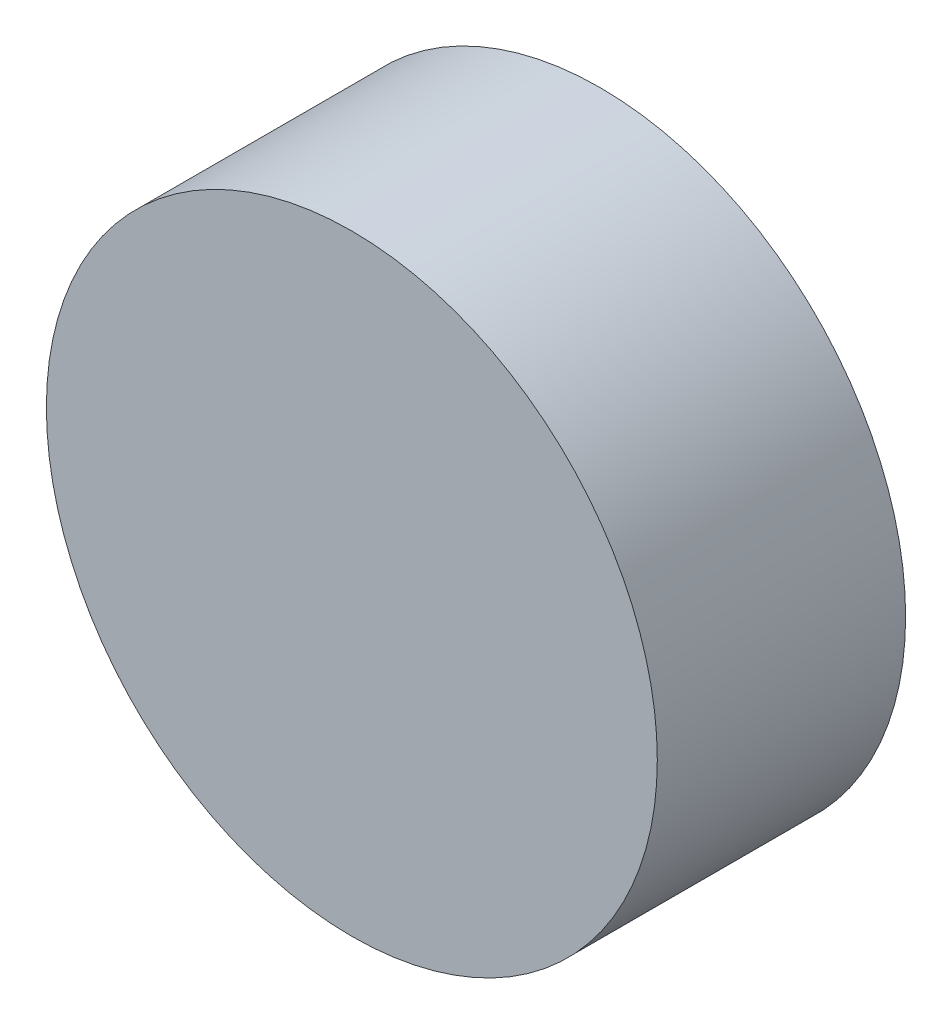
from build123d import *

# Parameters (mm, degrees)
SKETCH1_R           = 3.875
BOSS_EXTRUDE1_DEPTH = 3.15
SHELL1_T            = -1.45


with BuildPart() as part:
    # Sketch1 → Boss-Extrude1 (new body)
    with BuildSketch(Plane.XY):
        Circle(SKETCH1_R)
    extrude(amount=-BOSS_EXTRUDE1_DEPTH)

    # Shell1
    shell1_openings = [part.faces().sort_by_distance(p)[0] for p in [
        (0, 0, -3.15),
    ]]
    offset(amount=SHELL1_T, openings=shell1_openings, kind=Kind.INTERSECTION)


solid = part.part
